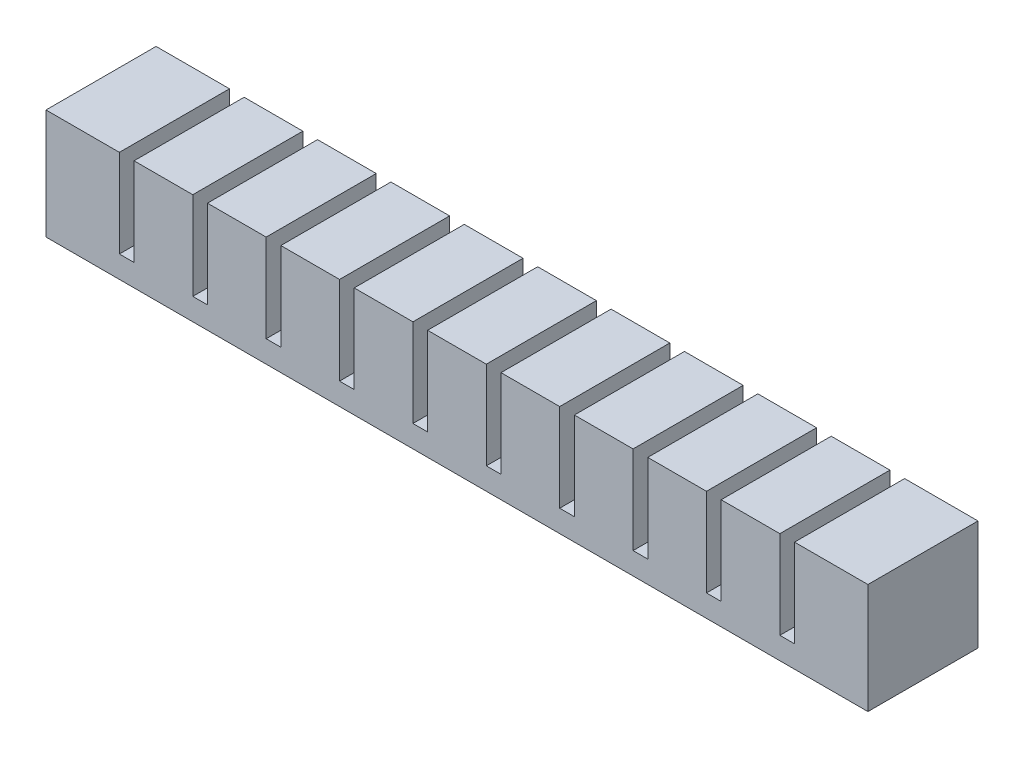
from build123d import *

# Parameters (mm, degrees)
SKETCH1_W                       = 8
SKETCH1_H                       = 15
FIRST_CHAMBER_BLOCK_DEPTH       = 15
SKETCH2_W                       = 6
SKETCH2_H                       = 11
FIRST_CHAMBER_CAVITY_DEPTH      = 13
SKETCH3_W                       = 15
SKETCH3_H                       = 3
CHAMBER_SPACER_DEPTH            = 2
PATTERN_CHAMBERS_COUNT          = 11
PATTERN_CHAMBERS_PITCH          = 10
SKETCH4_W                       = 15
SKETCH4_H                       = 12
THICKEN_END_1_DEPTH             = 2
SKETCH5_W                       = 15
SKETCH5_H                       = 15
THICKEN_END_2_DEPTH             = 2
SKETCH6_W                       = 94
SKETCH6_H                       = 2
CENTRAL_AIR_CHANNEL_DEPTH       = 2
SKETCH7_W                       = 108
SKETCH7_H                       = 13
SKETCH7_W_2                     = 106
SKETCH7_H_2                     = 11
BONDING_RIDGE_DEPTH             = 2
SKETCH9_W                       = 2
SKETCH9_H                       = 2.5
BONDING_BUMPS_DEPTH             = 2
PATTERN_BONDING_BUMPS_COUNT     = 10
PATTERN_BONDING_BUMPS_PITCH     = 10
SKIZZE1_W                       = 112
SKIZZE1_H                       = 15
SCHNITT_LINEAR_AUSTRAGEN1_DEPTH = 113.026782512
SKIZZE4_R                       = 1.25
SCHNITT_LINEAR_AUSTRAGEN3_DEPTH = 112.776562839


with BuildPart() as part:
    # Sketch1 → first chamber block (new body)
    with BuildSketch(Plane.XY):
        with Locations((4, 7.5)):
            Rectangle(SKETCH1_W, SKETCH1_H)
    extrude(amount=FIRST_CHAMBER_BLOCK_DEPTH)

    # Sketch2 → first chamber cavity (cut)
    with BuildSketch(Plane.XZ):
        with Locations((4, 7.5)):
            Rectangle(SKETCH2_W, SKETCH2_H)
    extrude(amount=-FIRST_CHAMBER_CAVITY_DEPTH, mode=Mode.SUBTRACT)

    # Sketch3 → chamber spacer (add)
    with BuildSketch(Plane(origin=(8, 0, 0), x_dir=(0, 0, -1), z_dir=(1, 0, 0))):
        with Locations((-7.5, 1.5)):
            Rectangle(SKETCH3_W, SKETCH3_H)
    extrude(amount=CHAMBER_SPACER_DEPTH)


with BuildPart() as pattern_chambers_1:
    # pattern chambers: pattern copy
    add(part.part.moved(Location(Vector(1, 0, 0) * (1 * PATTERN_CHAMBERS_PITCH))))


with BuildPart() as pattern_chambers_2:
    # pattern chambers: pattern copy
    add(part.part.moved(Location(Vector(1, 0, 0) * (2 * PATTERN_CHAMBERS_PITCH))))


with BuildPart() as pattern_chambers_3:
    # pattern chambers: pattern copy
    add(part.part.moved(Location(Vector(1, 0, 0) * (3 * PATTERN_CHAMBERS_PITCH))))


with BuildPart() as pattern_chambers_4:
    # pattern chambers: pattern copy
    add(part.part.moved(Location(Vector(1, 0, 0) * (4 * PATTERN_CHAMBERS_PITCH))))


with BuildPart() as pattern_chambers_5:
    # pattern chambers: pattern copy
    add(part.part.moved(Location(Vector(1, 0, 0) * (5 * PATTERN_CHAMBERS_PITCH))))


with BuildPart() as pattern_chambers_6:
    # pattern chambers: pattern copy
    add(part.part.moved(Location(Vector(1, 0, 0) * (6 * PATTERN_CHAMBERS_PITCH))))


with BuildPart() as pattern_chambers_7:
    # pattern chambers: pattern copy
    add(part.part.moved(Location(Vector(1, 0, 0) * (7 * PATTERN_CHAMBERS_PITCH))))


with BuildPart() as pattern_chambers_8:
    # pattern chambers: pattern copy
    add(part.part.moved(Location(Vector(1, 0, 0) * (8 * PATTERN_CHAMBERS_PITCH))))


with BuildPart() as pattern_chambers_9:
    # pattern chambers: pattern copy
    add(part.part.moved(Location(Vector(1, 0, 0) * (9 * PATTERN_CHAMBERS_PITCH))))


with BuildPart() as pattern_chambers_10:
    # pattern chambers: pattern copy
    add(part.part.moved(Location(Vector(1, 0, 0) * (10 * PATTERN_CHAMBERS_PITCH))))

    # combine into 1 solid body: union pattern chambers_9, pattern chambers_8, pattern chambers_7, pattern chambers_6, pattern chambers_5, pattern chambers_4, pattern chambers_3, pattern chambers_2, pattern chambers_1, part
    add(pattern_chambers_9.part)
    add(pattern_chambers_8.part)
    add(pattern_chambers_7.part)
    add(pattern_chambers_6.part)
    add(pattern_chambers_5.part)
    add(pattern_chambers_4.part)
    add(pattern_chambers_3.part)
    add(pattern_chambers_2.part)
    add(pattern_chambers_1.part)
    add(part.part)

    # Sketch4 → thicken end 1 (add)
    with BuildSketch(Plane(origin=(108, 0, 0), x_dir=(0, 0, -1), z_dir=(1, 0, 0))):
        with Locations((-7.5, 9)):
            Rectangle(SKETCH4_W, SKETCH4_H)
    extrude(amount=THICKEN_END_1_DEPTH)

    # Sketch5 → thicken end 2 (add)
    with BuildSketch(Plane.ZY):
        with Locations((7.5, 7.5)):
            Rectangle(SKETCH5_W, SKETCH5_H)
    extrude(amount=THICKEN_END_2_DEPTH)

    # Sketch6 → central air channel (cut)
    with BuildSketch(Plane.XZ):
        with Locations((54, 7.5)):
            Rectangle(SKETCH6_W, SKETCH6_H)
    extrude(amount=-CENTRAL_AIR_CHANNEL_DEPTH, mode=Mode.SUBTRACT)

    # Sketch7 → bonding ridge (add)
    with BuildSketch(Plane.XZ):
        with Locations((54, 7.5)):
            Rectangle(SKETCH7_W, SKETCH7_H)
        with Locations((54, 7.5)):
            Rectangle(SKETCH7_W_2, SKETCH7_H_2, mode=Mode.SUBTRACT)
    extrude(amount=BONDING_RIDGE_DEPTH)

    # Sketch9 → bonding bumps (add)
    with BuildSketch(Plane.XZ):
        with Locations((9, 10.75)):
            Rectangle(SKETCH9_W, SKETCH9_H)
        with Locations((9, 4.25)):
            Rectangle(SKETCH9_W, SKETCH9_H)
    bonding_bumps = extrude(amount=BONDING_BUMPS_DEPTH)

    # pattern bonding bumps: bonding bumps ×10
    with Locations(*[(i * PATTERN_BONDING_BUMPS_PITCH, 0, 0) for i in range(1, PATTERN_BONDING_BUMPS_COUNT)]):
        add(bonding_bumps)

    # Skizze1 → Schnitt-Linear austragen1 (cut, through all)
    with BuildSketch(Plane.XZ):
        with Locations((54, 7.5)):
            Rectangle(SKIZZE1_W, SKIZZE1_H)
    extrude(amount=SCHNITT_LINEAR_AUSTRAGEN1_DEPTH, mode=Mode.SUBTRACT)

    # Skizze4 → Schnitt-Linear austragen3 (cut, through all)
    with BuildSketch(Plane.XY.offset(2)):
        with Locations((4, 6.5)):
            Circle(SKIZZE4_R)
    extrude(amount=-SCHNITT_LINEAR_AUSTRAGEN3_DEPTH, mode=Mode.SUBTRACT)


solid = pattern_chambers_10.part
